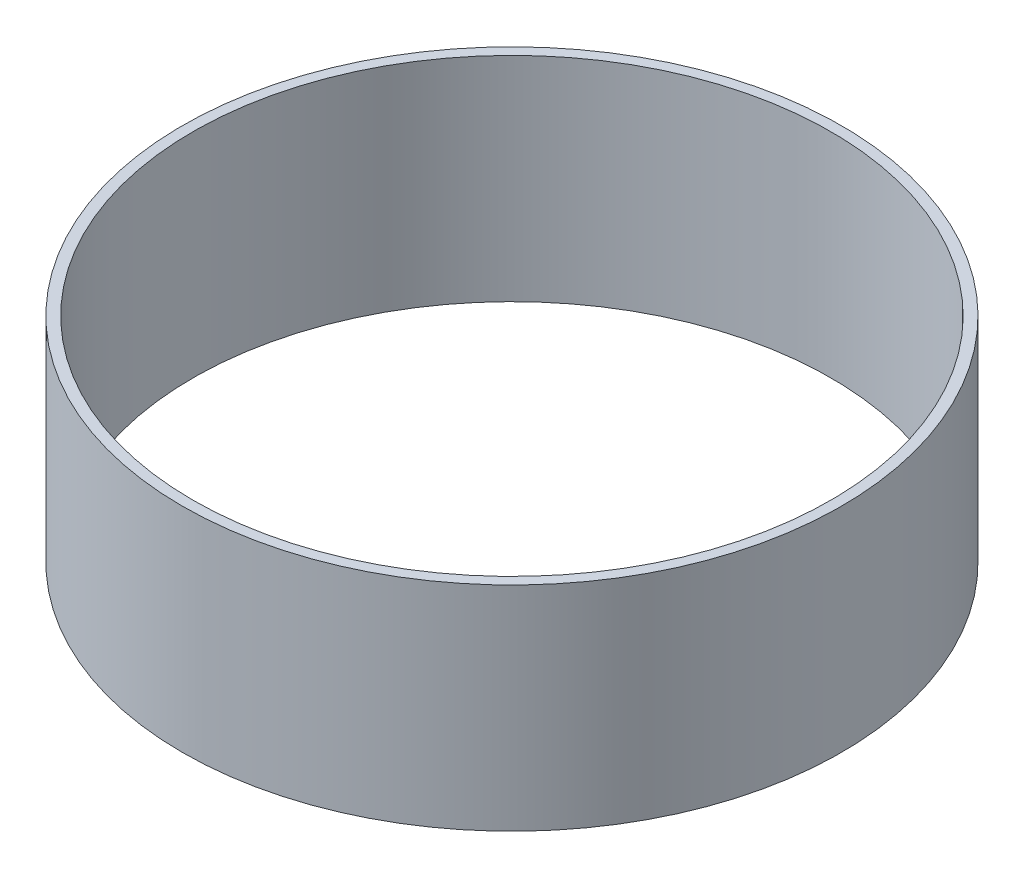
from build123d import *

# Parameters (mm, degrees)
SKETCH1_R           = 78.5
SKETCH1_R_2         = 76
BOSS_EXTRUDE1_DEPTH = 50.8


with BuildPart() as part:
    # Sketch1 → Boss-Extrude1 (new body)
    with BuildSketch(Plane(origin=(0, 0, 0), x_dir=(1, 0, 0), z_dir=(0, 1, 0))):
        with Locations(Location((0, 0, 0), (0, 0, 270))):
            Circle(SKETCH1_R)
        with Locations(Location((0, 0, 0), (0, 0, 270))):
            Circle(SKETCH1_R_2, mode=Mode.SUBTRACT)
    extrude(amount=BOSS_EXTRUDE1_DEPTH)


solid = part.part
